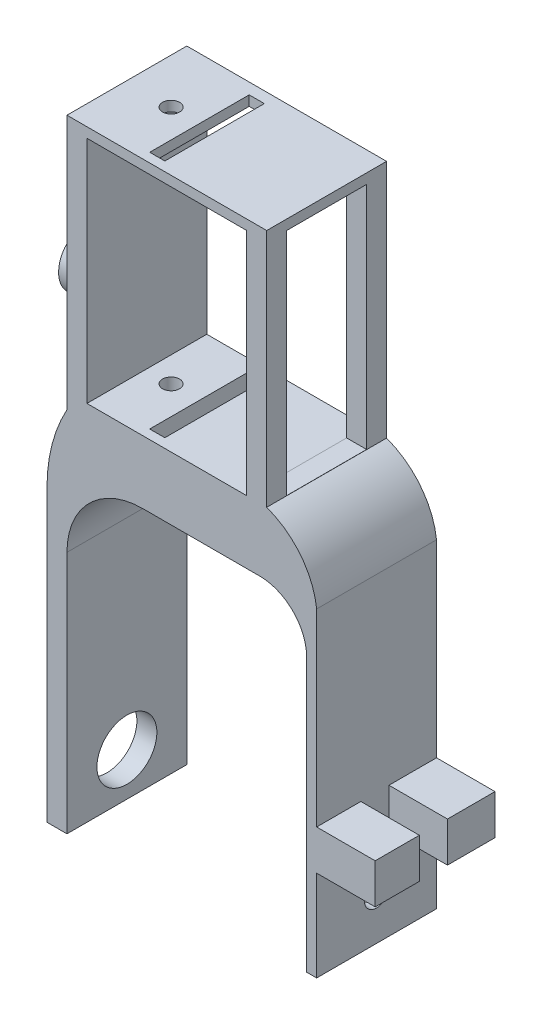
from build123d import *

# Parameters (mm, degrees)
BOSS_EXTRUDE1_DEPTH = 30
SKETCH8_W           = 20
SKETCH8_H           = 57.459356161
CUT_EXTRUDE10_DEPTH = 10
SKETCH9_W           = 40
SKETCH9_H           = 57.485293174
CUT_EXTRUDE11_DEPTH = 166.571948334
SKETCH10_W          = 3.787442447
SKETCH10_H          = 24.89779836
CUT_EXTRUDE12_DEPTH = 173.957782681
SKETCH11_R          = 7.5
BOSS_EXTRUDE3_DEPTH = 10
SKETCH13_W          = 7.039311569
SKETCH13_H          = 10
CUT_EXTRUDE13_DEPTH = 14.644416288
CUT_EXTRUDE14_DEPTH = 10
CUT_EXTRUDE15_START = -10
SKETCH15_R          = 7.5
SKETCH15_R_2        = 3.05
CUT_EXTRUDE15_DEPTH = 10
SKETCH16_R          = 2.125
CUT_EXTRUDE16_DEPTH = 173.957782681


with BuildPart() as part:
    # Sketch1 → Boss-Extrude1 (new body)
    with BuildSketch(Plane.XY):
        with BuildLine():
            Line((-13.258302459, -8.24297657), (-8.258302459, -8.24297657))
            Line((-8.258302459, -8.24297657), (-8.258302459, 52.783973791))
            ThreePointArc((-8.258302459, 52.783973791), (-2.701224879, 66.199945851), (10.714747181, 71.75702343))
            Line((10.714747181, 71.75702343), (40.003717522, 71.75702343))
            ThreePointArc((40.003717522, 71.75702343), (48.303722791, 68.31904868), (51.741697541, 60.019043411))
            Line((51.741697541, 60.019043411), (51.741697541, -8.24297657))
            Line((51.741697541, -8.24297657), (54.241697541, -8.24297657))
            Line((54.241697541, -8.24297657), (54.241697541, 14.491444052))
            Line((54.241697541, 14.491444052), (68.88611383, 14.491444052))
            Line((68.88611383, 14.491444052), (68.88611383, 24.491444052))
            Line((68.88611383, 24.491444052), (54.241697541, 24.491444052))
            Line((54.241697541, 24.491444052), (54.241697541, 71.75702343))
            ThreePointArc((54.241697541, 71.75702343), (50.23063048, 81.422678209), (41.741697541, 87.542446084))
            Line((41.741697541, 87.542446084), (41.741697541, 147.542446084))
            Line((41.741697541, 147.542446084), (-8.258302459, 147.542446084))
            Line((-8.258302459, 147.542446084), (-8.258302459, 83.691556541))
            ThreePointArc((-8.258302459, 83.691556541), (-11.988106196, 74.334235436), (-13.258302459, 64.341363194))
            Line((-13.258302459, 64.341363194), (-13.258302459, -8.24297657))
        make_face()
    extrude(amount=-BOSS_EXTRUDE1_DEPTH)

    # Sketch8 → Cut-Extrude10 (cut)
    with BuildSketch(Plane(origin=(41.741697541, 0, 0), x_dir=(0, 0, -1), z_dir=(1, 0, 0))):
        with Locations((15, 116.312768003)):
            Rectangle(SKETCH8_W, SKETCH8_H)
    extrude(amount=-CUT_EXTRUDE10_DEPTH, mode=Mode.SUBTRACT)

    # Sketch9 → Cut-Extrude11 (cut, through all)
    with BuildSketch(Plane.XY):
        with Locations((16.741697541, 116.299799497)):
            Rectangle(SKETCH9_W, SKETCH9_H)
    extrude(amount=-CUT_EXTRUDE11_DEPTH, mode=Mode.SUBTRACT)

    # Sketch10 → Cut-Extrude12 (cut, through all)
    with BuildSketch(Plane(origin=(0, 147.542446084, 0), x_dir=(1, 0, 0), z_dir=(0, 1, 0))):
        with Locations((12.030722262, 14.765280162)):
            Rectangle(SKETCH10_W, SKETCH10_H)
    extrude(amount=-CUT_EXTRUDE12_DEPTH, mode=Mode.SUBTRACT)

    # Sketch11 → Boss-Extrude3 (add)
    with BuildSketch(Plane.ZY.offset(8.258302459)):
        with Locations(Location((-15.40420704, 104.542446084, 0), (0, 0, 270))):
            Circle(SKETCH11_R)
    extrude(amount=BOSS_EXTRUDE3_DEPTH)

    # Sketch13 → Cut-Extrude13 (cut)
    with BuildSketch(Plane(origin=(68.88611383, 0, 0), x_dir=(0, 0, -1), z_dir=(1, 0, 0))):
        with Locations((14.579402423, 19.491444052)):
            Rectangle(SKETCH13_W, SKETCH13_H)
    extrude(amount=-CUT_EXTRUDE13_DEPTH, mode=Mode.SUBTRACT)

    # Sketch14 → Cut-Extrude14 (cut)
    with BuildSketch(Plane(origin=(54.241697541, 0, 0), x_dir=(0, 0, -1), z_dir=(1, 0, 0))):
        with BuildLine():
            ThreePointArc((15, 5.541444052), (11.95, 2.491444052), (15, -0.558555948))
            Line((15, -0.558555948), (15, 5.541444052))
        make_face()
        with BuildLine():
            Line((15, 5.541444052), (15, -0.558555948))
            ThreePointArc((15, -0.558555948), (17.156675683, 0.334768369), (18.05, 2.491444052))
            ThreePointArc((18.05, 2.491444052), (17.156675683, 4.648119734), (15, 5.541444052))
        make_face()
    extrude(amount=-CUT_EXTRUDE14_DEPTH, mode=Mode.SUBTRACT)

    # Sketch15 → Cut-Extrude15 (cut)
    # profile 1 of 2: a face of its own
    with BuildSketch(Plane.ZY.offset(13.258302459).offset(CUT_EXTRUDE15_START)):
        with Locations((-15, 2.491444052)):
            Circle(SKETCH15_R)
        with Locations(Location((-15, 2.491444052, 0), (0, 0, 180))):
            Circle(SKETCH15_R_2, mode=Mode.SUBTRACT)
    # profile 2 of 2: a face of its own
    with BuildSketch(Plane.ZY.offset(13.258302459).offset(CUT_EXTRUDE15_START)):
        with Locations(Location((-15, 2.491444052, 0), (0, 0, 180))):
            Circle(SKETCH15_R_2)
    extrude(amount=CUT_EXTRUDE15_DEPTH, mode=Mode.SUBTRACT)

    # Sketch16 → Cut-Extrude16 (cut, through all)
    with BuildSketch(Plane(origin=(0, 147.542446084, 0), x_dir=(1, 0, 0), z_dir=(0, 1, 0))):
        with Locations(Location((3.036064992, 14.765280162, 0), (0, 0, 270))):
            Circle(SKETCH16_R)
    extrude(amount=-CUT_EXTRUDE16_DEPTH, mode=Mode.SUBTRACT)


solid = part.part
